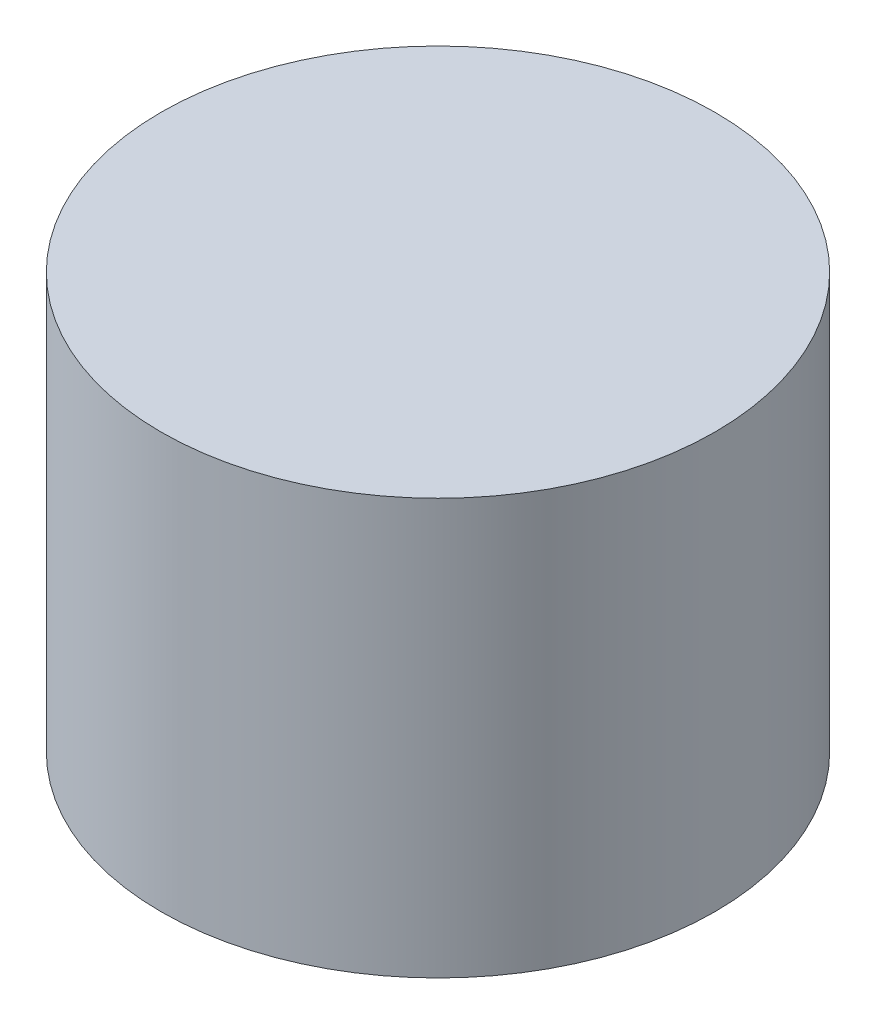
from build123d import *

# Parameters (mm, degrees)
SKETCH1_R           = 25.4
BOSS_EXTRUDE1_DEPTH = 38.1


with BuildPart() as part:
    # Sketch1 → Boss-Extrude1 (new body)
    with BuildSketch(Plane(origin=(0, 0, 0), x_dir=(1, 0, 0), z_dir=(0, 1, 0))):
        with Locations(Location((0, 0, 0), (0, 0, 90))):
            Circle(SKETCH1_R)
    extrude(amount=BOSS_EXTRUDE1_DEPTH)


solid = part.part
